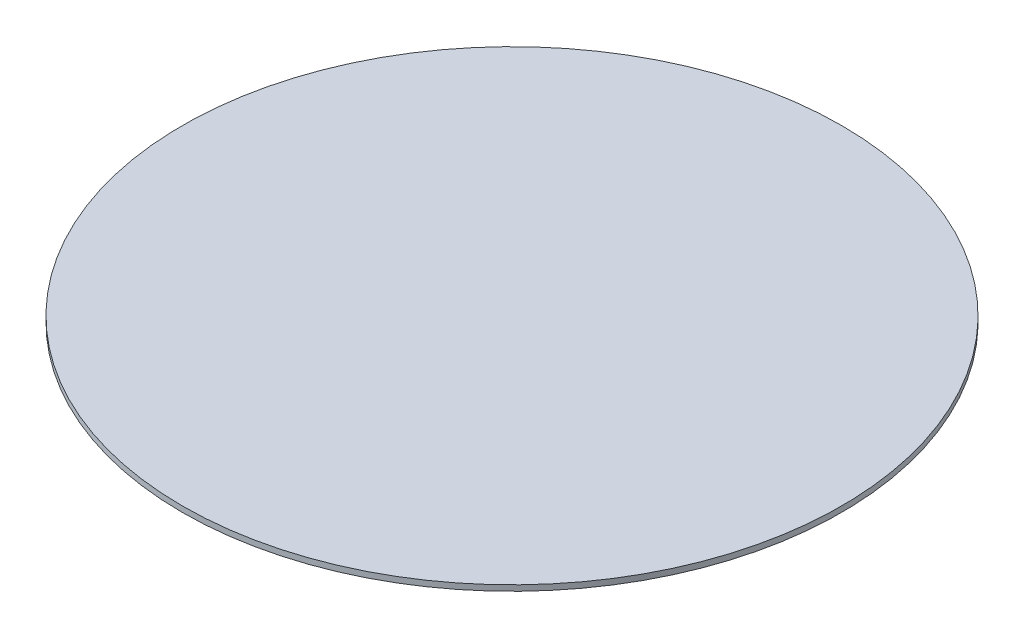
from build123d import *

# Parameters (mm, degrees)
SKETCH1_R           = 175
BOSS_EXTRUDE1_DEPTH = 3


with BuildPart() as part:
    # Sketch1 → Boss-Extrude1 (new body)
    with BuildSketch(Plane(origin=(0, 0, 0), x_dir=(1, 0, 0), z_dir=(0, 1, 0))):
        with Locations(Location((0, 0, 0), (0, 0, 270))):
            Circle(SKETCH1_R)
    extrude(amount=BOSS_EXTRUDE1_DEPTH)


solid = part.part
